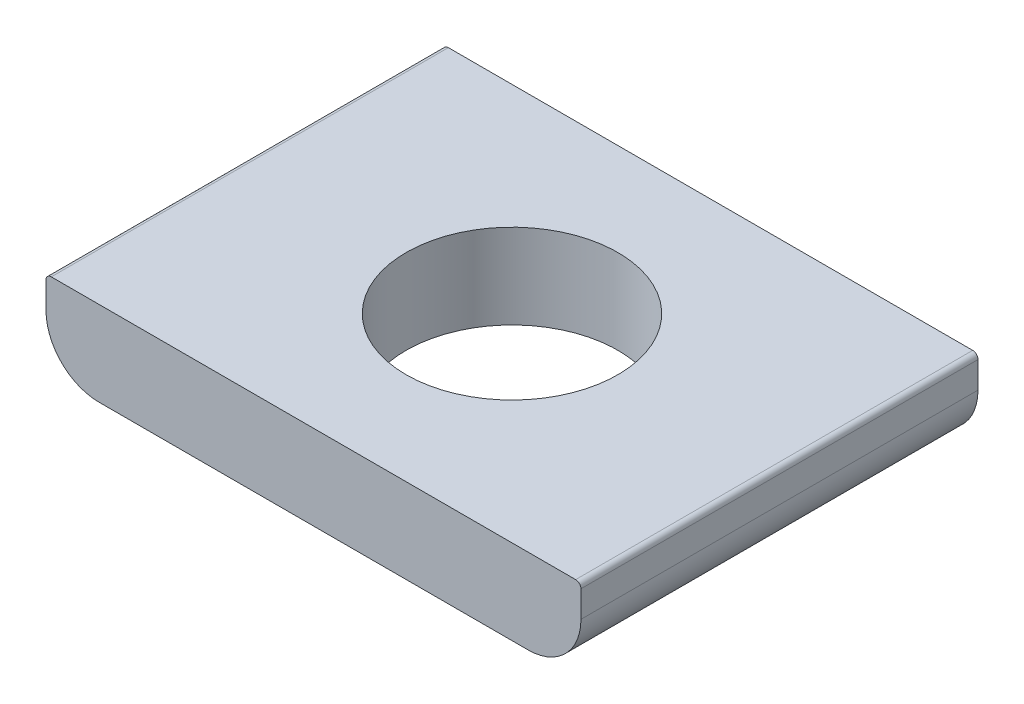
from build123d import *

# Parameters (mm, degrees)
BOSS_EXTRUDE1_DEPTH   = 15
F_8_0MM_DOWEL_HOLE1_D = 8


with BuildPart() as part:
    # Sketch1 → Boss-Extrude1 (new body)
    with BuildSketch(Plane.XY):
        with BuildLine():
            Line((9.905, 0), (-9.905, 0))
            ThreePointArc((-9.905, 0), (-10.046421356, -0.058578644), (-10.105, -0.2))
            Line((-10.105, -0.2), (-10.105, -1.2))
            ThreePointArc((-10.105, -1.2), (-9.519213562, -2.614213562), (-8.105, -3.2))
            Line((-8.105, -3.2), (8.105, -3.2))
            ThreePointArc((8.105, -3.2), (9.519213562, -2.614213562), (10.105, -1.2))
            Line((10.105, -1.2), (10.105, -0.2))
            ThreePointArc((10.105, -0.2), (10.046421356, -0.058578644), (9.905, 0))
        make_face()
    extrude(amount=BOSS_EXTRUDE1_DEPTH)

    # Ø8.0mm Dowel Hole1 (through all)
    with Locations(Plane(origin=(0, 0, 0), x_dir=(1, 0, 0), z_dir=(0, 1, 0))):
        with Locations((0, -7.5)):
            Hole(F_8_0MM_DOWEL_HOLE1_D / 2)


solid = part.part
